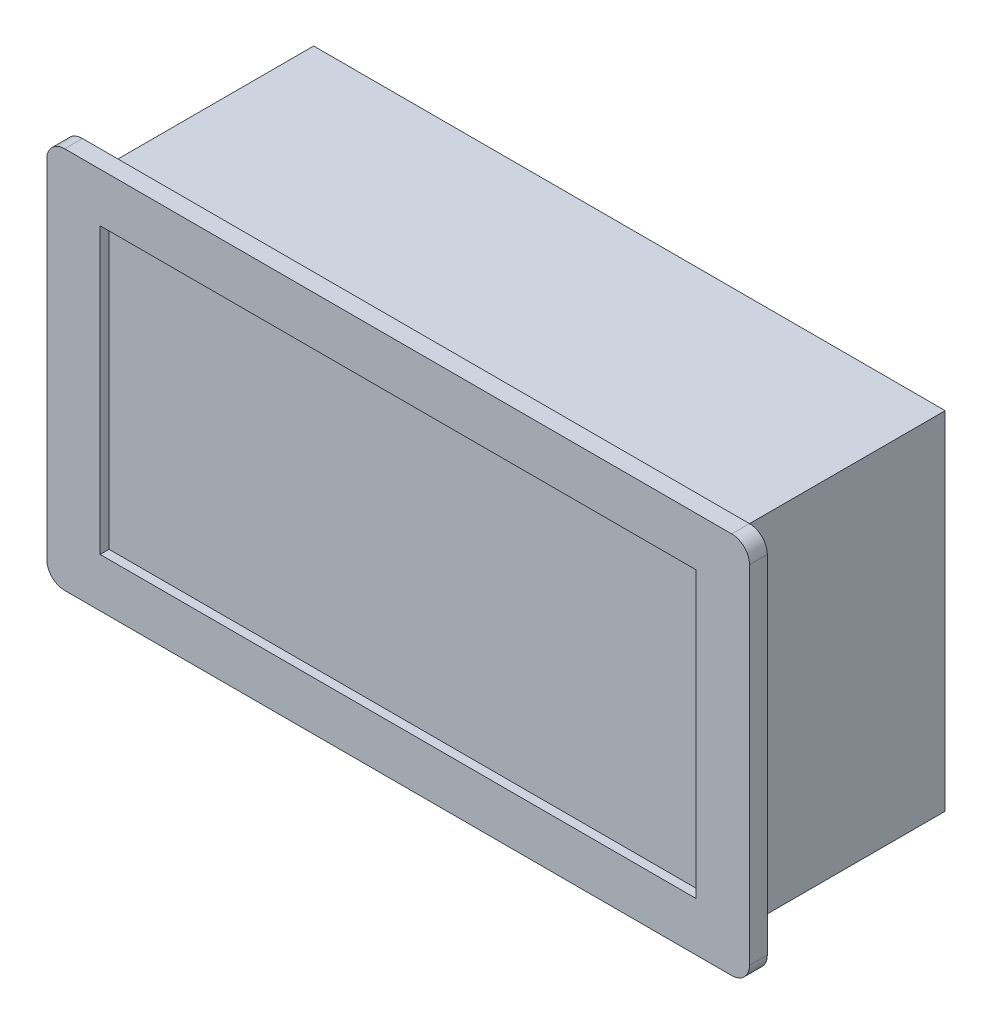
from build123d import *

# Parameters (mm, degrees)
SKETCH_1_W          = 71
SKETCH_1_H          = 39
EXTRUDE_1_DEPTH     = 24
EXTRUDE_2_DEPTH     = 2
SKETCH_3_W          = 67
SKETCH_3_H          = 32
CUT_EXTRUDE_1_DEPTH = 1


with BuildPart() as part:
    # 草图1 → 凸台-拉伸1 (new body)
    with BuildSketch(Plane.XY):
        Rectangle(SKETCH_1_W, SKETCH_1_H)
    extrude(amount=EXTRUDE_1_DEPTH)

    # 草图2 → 凸台-拉伸2 (add)
    with BuildSketch(Plane.XY.offset(24)):
        with BuildLine():
            Line((-37.5, -21.5), (37.5, -21.5))
            ThreePointArc((37.5, -21.5), (38.914213562, -20.914213562), (39.5, -19.5))
            Line((39.5, -19.5), (39.5, 19.5))
            ThreePointArc((39.5, 19.5), (38.914213562, 20.914213562), (37.5, 21.5))
            Line((37.5, 21.5), (-37.5, 21.5))
            ThreePointArc((-37.5, 21.5), (-38.914213562, 20.914213562), (-39.5, 19.5))
            Line((-39.5, 19.5), (-39.5, -19.5))
            ThreePointArc((-39.5, -19.5), (-38.914213562, -20.914213562), (-37.5, -21.5))
        make_face()
    extrude(amount=EXTRUDE_2_DEPTH)

    # 草图3 → 切除-拉伸1 (cut)
    with BuildSketch(Plane.XY.offset(26)):
        Rectangle(SKETCH_3_W, SKETCH_3_H)
    extrude(amount=-CUT_EXTRUDE_1_DEPTH, mode=Mode.SUBTRACT)


solid = part.part
